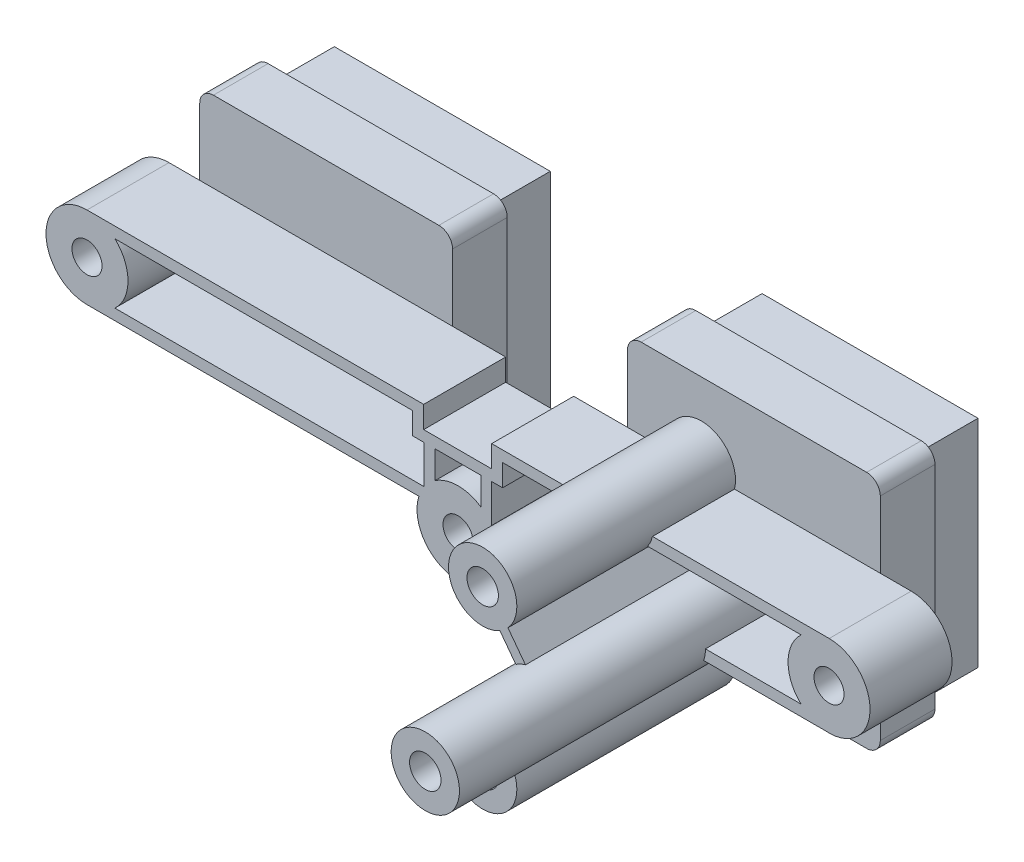
from build123d import *

# Parameters (mm, degrees)
ESQUISSE1_R        = 3
ESQUISSE1_R_2      = 1.1
EXTRUSION1_DEPTH   = 6
EXTRUSION1_2_DEPTH = 6
EXTRUSION1_3_DEPTH = 6
EXTRUSION2_DEPTH   = 6
ESQUISSE3_W        = 15.8
ESQUISSE3_H        = 15.8
EXTRUSION3_DEPTH   = 8.5
EXTRUSION4_DEPTH   = 4
ESQUISSE5_R        = 2.5
ESQUISSE5_R_2      = 1.15
EXTRUSION5_DEPTH   = 24
ESQUISSE6_R        = 2.5
ESQUISSE6_R_2      = 1.15
EXTRUSION6_DEPTH   = 16
EXTRUSION7_DEPTH   = 16


with BuildPart() as part:
    # Esquisse1 → Extrusion1 (new body)
    with BuildSketch(Plane.XY):
        with Locations((-27.15, 42.398738828)):
            Circle(ESQUISSE1_R)
        with Locations((-27.15, 42.398738828)):
            Circle(ESQUISSE1_R_2, mode=Mode.SUBTRACT)
    extrude(amount=EXTRUSION1_DEPTH)



with BuildPart() as body_2:
    # Esquisse1 → Extrusion1 2 (new body)
    with BuildSketch(Plane.XY):
        with Locations((0, 38.498738828)):
            Circle(ESQUISSE1_R)
        with Locations((0, 38.498738828)):
            Circle(ESQUISSE1_R_2, mode=Mode.SUBTRACT)
    extrude(amount=EXTRUSION1_2_DEPTH)


with BuildPart() as body_3:
    # Esquisse1 → Extrusion1 3 (new body)
    with BuildSketch(Plane.XY):
        with Locations((27.15, 42.398738828)):
            Circle(ESQUISSE1_R)
        with Locations((27.15, 42.398738828)):
            Circle(ESQUISSE1_R_2, mode=Mode.SUBTRACT)
    extrude(amount=EXTRUSION1_3_DEPTH)


with BuildPart() as part_1:
    add(part.part)

    add(body_2.part)  # Extrusion2 merges body 2

    add(body_3.part)  # Extrusion2 merges body 3
    # Esquisse2 → Extrusion2 (add)
    with BuildSketch(Plane.XY.offset(6)):
        Polygon((-27.15, 45.398738828), (-2.513675589, 45.398738828), (-2.513675589, 44.598738828), (-2.513675589, 43.7970137), (2.463807407, 43.7970137), (2.463807407, 44.724328248), (2.463807407, 45.398738828), (27.161568979, 45.398738828), (27.161568979, 44.598738828), (3.263807407, 44.598738828), (3.263807407, 42.9970137), (2.463807407, 42.9970137), (2.463807407, 40.21036176), (27.413822862, 40.21036176), (27.413822862, 39.41036176), (2.20772744, 39.41036176), (1.663807407, 39.41036176), (1.663807407, 42.9970137), (-1.671841419, 42.9970137), (-1.671841419, 39.398738828), (-2.471841419, 39.398738828), (-27.15, 39.398738828), (-27.15, 40.198738828), (-2.471841419, 40.198738828), (-2.471841419, 42.9970137), (-3.313675589, 42.9970137), (-3.313675589, 44.598738828), (-27.15, 44.598738828), align=None)
    extrude(amount=-EXTRUSION2_DEPTH)

    # Esquisse3 → Extrusion3 (add)
    with BuildSketch(Plane(origin=(0, 0, 0), x_dir=(-1, 0, 0), z_dir=(0, 0, -1))):
        with Locations((15.65, 42.398738828)):
            Rectangle(ESQUISSE3_W, ESQUISSE3_H)
        with Locations((-15.65, 42.398738828)):
            Rectangle(ESQUISSE3_W, ESQUISSE3_H)
    extrude(amount=EXTRUSION3_DEPTH)

    # Esquisse4 → Extrusion4 (add)
    with BuildSketch(Plane(origin=(0, 0, 0), x_dir=(-1, 0, 0), z_dir=(0, 0, -1))):
        with BuildLine():
            Line((7.4, 33.798738828), (23.9, 33.798738828))
            ThreePointArc((23.9, 33.798738828), (24.607106781, 34.091632046), (24.9, 34.798738828))
            Line((24.9, 34.798738828), (24.9, 50.298738828))
            ThreePointArc((24.9, 50.298738828), (24.607106781, 51.005845609), (23.9, 51.298738828))
            Line((23.9, 51.298738828), (7.4, 51.298738828))
            ThreePointArc((7.4, 51.298738828), (6.692893219, 51.005845609), (6.4, 50.298738828))
            Line((6.4, 50.298738828), (6.4, 34.798738828))
            ThreePointArc((6.4, 34.798738828), (6.692893219, 34.091632046), (7.4, 33.798738828))
        make_face()
        with BuildLine():
            Line((-6.4, 34.798738828), (-6.4, 50.298738828))
            ThreePointArc((-6.4, 50.298738828), (-6.692893219, 51.005845609), (-7.4, 51.298738828))
            Line((-7.4, 51.298738828), (-23.9, 51.298738828))
            ThreePointArc((-23.9, 51.298738828), (-24.607106781, 51.005845609), (-24.9, 50.298738828))
            Line((-24.9, 50.298738828), (-24.9, 34.798738828))
            ThreePointArc((-24.9, 34.798738828), (-24.607106781, 34.091632046), (-23.9, 33.798738828))
            Line((-23.9, 33.798738828), (-7.4, 33.798738828))
            ThreePointArc((-7.4, 33.798738828), (-6.692893219, 34.091632046), (-6.4, 34.798738828))
        make_face()
    extrude(amount=EXTRUSION4_DEPTH)

    # Esquisse5 → Extrusion5 (add)
    with BuildSketch(Plane.XY):
        with Locations(Location((15.605002706, 40.204414181, 0), (0, 0, 179.863691409))):
            Circle(ESQUISSE5_R)
        with Locations(Location((15.605002706, 40.204414181, 0), (0, 0, 179.703675934))):
            Circle(ESQUISSE5_R_2, mode=Mode.SUBTRACT)
    extrude(amount=EXTRUSION5_DEPTH)

    # Esquisse6 → Extrusion6 (add)
    # profile 1 of 5: a face of its own
    with BuildSketch(Plane.XY):
        with BuildLine():
            ThreePointArc((10.827425412, 33.798738828), (11.490132803, 35.510468856), (12.955002706, 34.404414181))
            ThreePointArc((12.955002706, 34.404414181), (12.911057381, 34.089544278), (12.78258, 33.798738828))
            Line((12.78258, 33.798738828), (14.230524787, 33.798738828))
            ThreePointArc((14.230524787, 33.798738828), (14.286313368, 34.099295518), (14.305002706, 34.404414181))
            ThreePointArc((14.305002706, 34.404414181), (11.499884043, 36.885724843), (9.379480625, 33.798738828))
            Line((9.379480625, 33.798738828), (10.827425412, 33.798738828))
        make_face()
    # profile 2 of 5: a face of its own
    with BuildSketch(Plane.XY):
        with BuildLine():
            ThreePointArc((12.78258, 33.798738828), (11.805002706, 33.254414181), (10.827425412, 33.798738828))
            Line((10.827425412, 33.798738828), (9.379480625, 33.798738828))
            ThreePointArc((9.379480625, 33.798738828), (11.805002706, 31.904414181), (14.230524787, 33.798738828))
            Line((14.230524787, 33.798738828), (12.78258, 33.798738828))
        make_face()
    # profile 3 of 5: a face of its own
    with BuildSketch(Plane.XY):
        with BuildLine():
            ThreePointArc((10.827425412, 33.798738828), (11.490132803, 35.510468856), (12.955002706, 34.404414181))
            ThreePointArc((12.955002706, 34.404414181), (12.911057381, 34.089544278), (12.78258, 33.798738828))
            Line((12.78258, 33.798738828), (14.230524787, 33.798738828))
            ThreePointArc((14.230524787, 33.798738828), (14.286313368, 34.099295518), (14.305002706, 34.404414181))
            ThreePointArc((14.305002706, 34.404414181), (11.499884043, 36.885724843), (9.379480625, 33.798738828))
            Line((9.379480625, 33.798738828), (10.827425412, 33.798738828))
        make_face()
    # profile 4 of 5: a face of its own
    with BuildSketch(Plane.XY):
        with BuildLine():
            ThreePointArc((12.78258, 33.798738828), (11.805002706, 33.254414181), (10.827425412, 33.798738828))
            Line((10.827425412, 33.798738828), (9.379480625, 33.798738828))
            ThreePointArc((9.379480625, 33.798738828), (11.805002706, 31.904414181), (14.230524787, 33.798738828))
            Line((14.230524787, 33.798738828), (12.78258, 33.798738828))
        make_face()
    # profile 5 of 5: a face of its own
    with BuildSketch(Plane.XY):
        with Locations(Location((11.805002706, 46.004414181, 0), (0, 0, 194.020564777))):
            Circle(ESQUISSE6_R)
        with Locations(Location((11.805002706, 46.004414181, 0), (0, 0, 211.781019499))):
            Circle(ESQUISSE6_R_2, mode=Mode.SUBTRACT)
    extrude(amount=EXTRUSION6_DEPTH)

    # Esquisse7 → Extrusion7 (add)
    with BuildSketch(Plane.XY.offset(16)):
        Polygon((12.558485139, 36.446515131), (14.292905081, 38.694837279), (14.882025317, 38.240373098), (12.955002706, 35.742380824), align=None)
        Polygon((13.393576222, 44.668950414), (15.320709492, 42.099439388), (14.71430489, 41.644635937), (12.955002706, 43.990372182), align=None)
    extrude(amount=-EXTRUSION7_DEPTH)


solid = part_1.part
